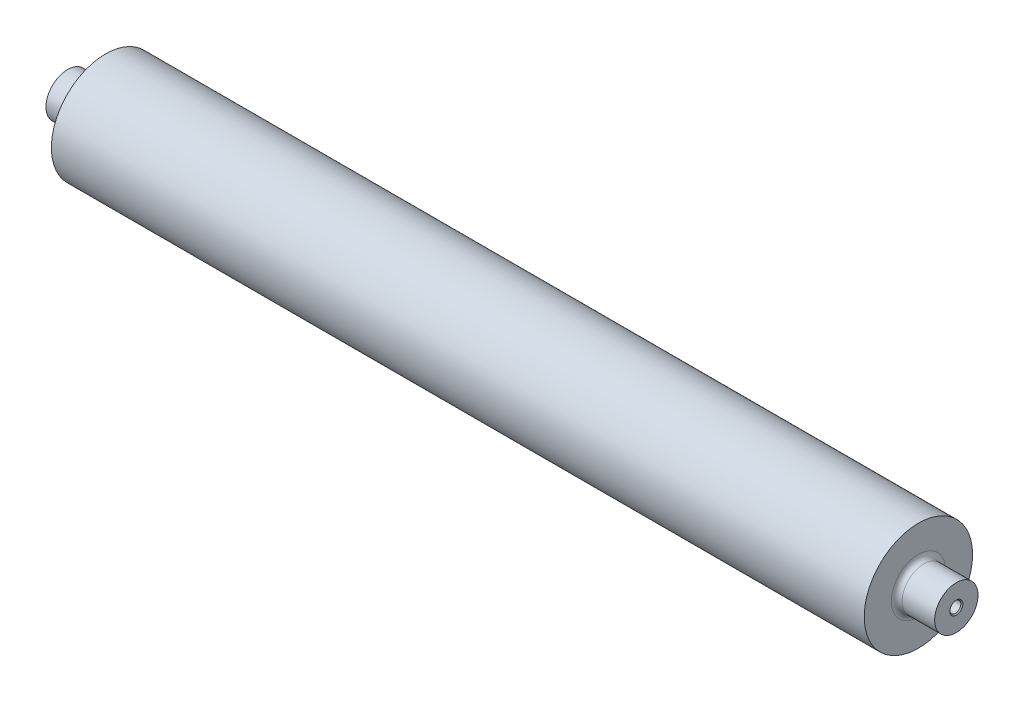
from build123d import *

# Parameters (mm, degrees)
FILLET1_R                              = 5
M12_TAPPED_HOLE4_D                     = 10.2
M12_TAPPED_HOLE4_DEPTH                 = 29.25
M12_TAPPED_HOLE4_CSINK_D               = 12.05
M12_TAPPED_HOLE4_CSINK_ANGLE           = 90
M12_TAPPED_HOLE4_TIP                   = 3.064389157
M12_TAPPED_HOLE4_ON_FACE_2_D           = 10.2
M12_TAPPED_HOLE4_ON_FACE_2_DEPTH       = 29.25
M12_TAPPED_HOLE4_ON_FACE_2_CSINK_D     = 12.05
M12_TAPPED_HOLE4_ON_FACE_2_CSINK_ANGLE = 90
M12_TAPPED_HOLE4_ON_FACE_2_TIP         = 3.064389157


with BuildPart() as part:
    # Sketch1 → Revolve1 (revolve)
    with BuildSketch(Plane.XY, mode=Mode.PRIVATE) as revolve1_sk:
        Polygon((0, 0), (0, 20), (35, 20), (35, 50), (785, 50), (785, 20), (820, 20), (820, 0), align=None)
    revolve(revolve1_sk.sketch.rotate(Axis((820, 0, 0), (-1, 0, 0)), 90), axis=Axis((820, 0, 0), (-1, 0, 0)))

    # Fillet1
    fillet1_edges = [part.edges().sort_by_distance(p)[0] for p in [
        (785, 0, 20),
        (35, 0, 20),
    ]]
    fillet(fillet1_edges, radius=FILLET1_R)

    # M12 Tapped Hole4
    with Locations(Plane(origin=(0, 0, 0), x_dir=(0, 0, -1), z_dir=(-1, 0, 0))):
        with Locations((0, 0)):
            CounterSinkHole(M12_TAPPED_HOLE4_D / 2, M12_TAPPED_HOLE4_CSINK_D / 2, depth=M12_TAPPED_HOLE4_DEPTH, counter_sink_angle=M12_TAPPED_HOLE4_CSINK_ANGLE)
            with Locations((0, 0, -(M12_TAPPED_HOLE4_DEPTH + M12_TAPPED_HOLE4_TIP / 2))):  # 118° drill point
                Cone(0, M12_TAPPED_HOLE4_D / 2, M12_TAPPED_HOLE4_TIP, mode=Mode.SUBTRACT)

    # M12 Tapped Hole4 on face 2
    with Locations(Plane(origin=(820, 0, 0), x_dir=(0, 0, 1), z_dir=(1, 0, 0))):
        with Locations((0, 0)):
            CounterSinkHole(M12_TAPPED_HOLE4_ON_FACE_2_D / 2, M12_TAPPED_HOLE4_ON_FACE_2_CSINK_D / 2, depth=M12_TAPPED_HOLE4_ON_FACE_2_DEPTH, counter_sink_angle=M12_TAPPED_HOLE4_ON_FACE_2_CSINK_ANGLE)
            with Locations((0, 0, -(M12_TAPPED_HOLE4_ON_FACE_2_DEPTH + M12_TAPPED_HOLE4_ON_FACE_2_TIP / 2))):  # 118° drill point
                Cone(0, M12_TAPPED_HOLE4_ON_FACE_2_D / 2, M12_TAPPED_HOLE4_ON_FACE_2_TIP, mode=Mode.SUBTRACT)


solid = part.part
